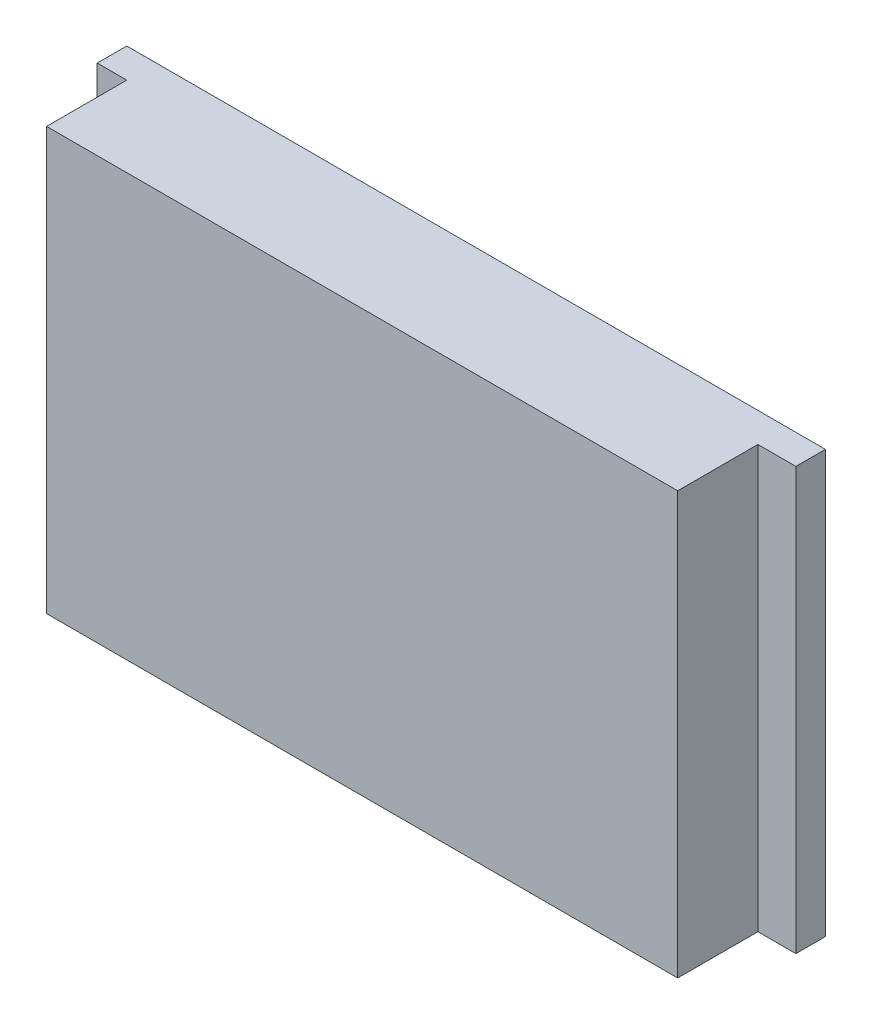
from build123d import *

# Parameters (mm, degrees)
ESQUISSE1_W        = 165.56
ESQUISSE1_H        = 100
BOSS_EXTRU_1_DEPTH = 7
ESQUISSE2_W        = 149.56
ESQUISSE2_H        = 100
BOSS_EXTRU_2_DEPTH = 19


with BuildPart() as part:
    # Esquisse1 → Boss.-Extru.1 (new body)
    with BuildSketch(Plane.XY):
        Rectangle(ESQUISSE1_W, ESQUISSE1_H)
    extrude(amount=BOSS_EXTRU_1_DEPTH)

    # Esquisse2 → Boss.-Extru.2 (add)
    with BuildSketch(Plane.XY.offset(7)):
        with Locations((-1, 0)):
            Rectangle(ESQUISSE2_W, ESQUISSE2_H)
    extrude(amount=BOSS_EXTRU_2_DEPTH)


solid = part.part
